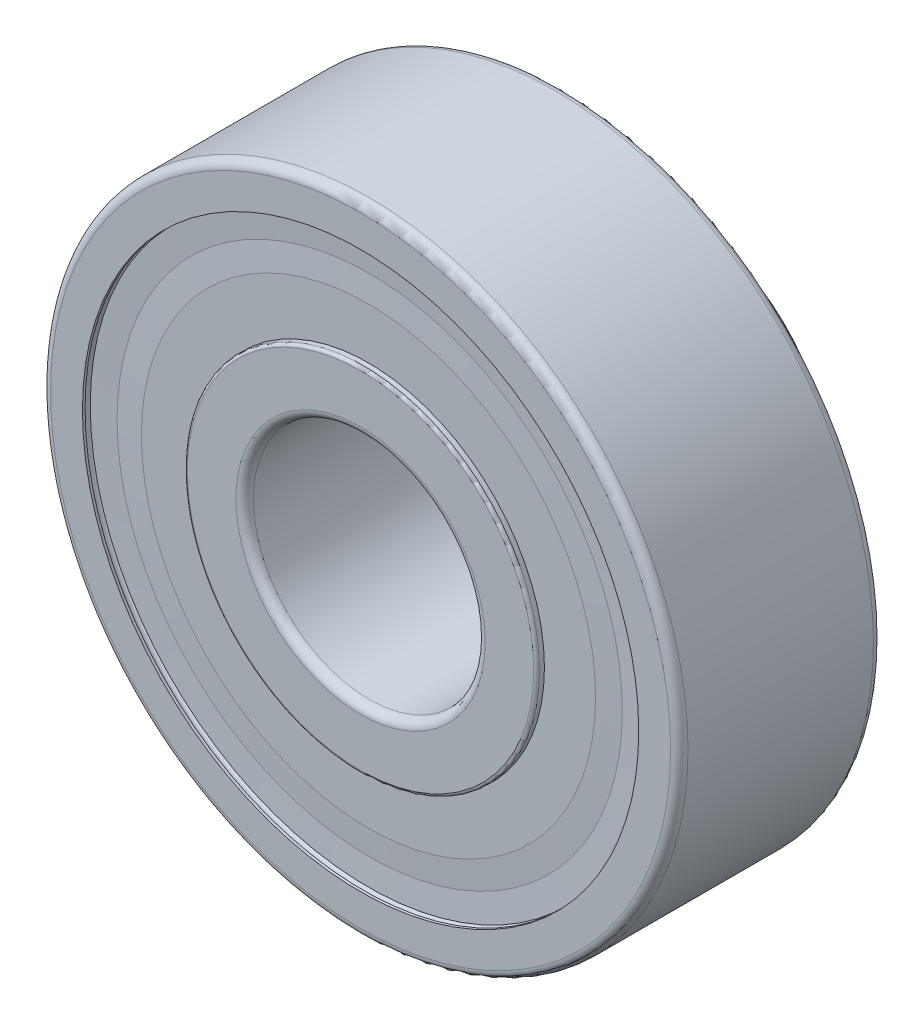
from build123d import *

# Parameters (mm, degrees)
BALL_PATTERN_COUNT              = 7
M3_SET_SCREW_HOLE_PATTERN_COUNT = 2
M3_SET_SCREW_HOLE_PATTERN_ANGLE = 90


with BuildPart() as part:
    # Sketch1 → Bearing Body (revolve)
    with BuildSketch(Plane(origin=(0, 0, 0), x_dir=(0, 0, -1), z_dir=(1, 0, 0))):
        with BuildLine():
            Line((-3.2, 4), (3.2, 4))
            Line((3.2, 4), (7.05, 4))
            ThreePointArc((7.05, 4), (7.262132034, 4.087867966), (7.35, 4.3))
            Line((7.35, 4.3), (7.35, 5.35))
            ThreePointArc((7.35, 5.35), (7.320710678, 5.420710678), (7.25, 5.45))
            Line((7.25, 5.45), (3.6, 5.45))
            Line((3.6, 5.45), (3.5, 5.55))
            Line((3.5, 5.55), (3.5, 5.975))
            ThreePointArc((3.5, 5.975), (3.470710678, 6.045710678), (3.4, 6.075))
            Line((3.4, 6.075), (3.23, 6.075))
            Line((3.23, 6.075), (3.23, 7.8375))
            Line((3.23, 7.8375), (3.185, 8.71875))
            Line((3.185, 8.71875), (3.23, 9.6))
            Line((3.23, 9.6), (3.14, 9.6))
            Line((3.14, 9.6), (3.05, 8.71875))
            Line((3.05, 8.71875), (3.05, 7.8375))
            Line((3.05, 7.8375), (3.14, 6.075))
            Line((3.14, 6.075), (1.520728526, 6.075))
            ThreePointArc((1.520728526, 6.075), (0, 5.3655), (-1.520728526, 6.075))
            Line((-1.520728526, 6.075), (-3.14, 6.075))
            Line((-3.14, 6.075), (-3.05, 7.8375))
            Line((-3.05, 7.8375), (-3.05, 8.71875))
            Line((-3.05, 8.71875), (-3.14, 9.6))
            Line((-3.14, 9.6), (-3.23, 9.6))
            Line((-3.23, 9.6), (-3.185, 8.71875))
            Line((-3.185, 8.71875), (-3.23, 7.8375))
            Line((-3.23, 7.8375), (-3.23, 6.075))
            Line((-3.23, 6.075), (-3.4, 6.075))
            ThreePointArc((-3.4, 6.075), (-3.470710678, 6.045710678), (-3.5, 5.975))
            Line((-3.5, 5.975), (-3.5, 4.3))
            ThreePointArc((-3.5, 4.3), (-3.412132034, 4.087867966), (-3.2, 4))
        make_face()
        with BuildLine():
            Line((-3.5, 9.6), (-3.5, 10.7))
            ThreePointArc((-3.5, 10.7), (-3.412132034, 10.912132034), (-3.2, 11))
            Line((-3.2, 11), (3.2, 11))
            ThreePointArc((3.2, 11), (3.412132034, 10.912132034), (3.5, 10.7))
            Line((3.5, 10.7), (3.5, 9.6))
            Line((3.5, 9.6), (3.41, 9.6))
            ThreePointArc((3.41, 9.6), (3.23, 9.78), (3.05, 9.6))
            Line((3.05, 9.6), (2.908938415, 8.8))
            Line((2.908938415, 8.8), (1.354894922, 8.8))
            ThreePointArc((1.354894922, 8.8), (0, 9.3345), (-1.354894922, 8.8))
            Line((-1.354894922, 8.8), (-2.908938415, 8.8))
            Line((-2.908938415, 8.8), (-3.05, 9.6))
            ThreePointArc((-3.05, 9.6), (-3.23, 9.78), (-3.41, 9.6))
            Line((-3.41, 9.6), (-3.5, 9.6))
        make_face()
    revolve(axis=Axis((0, 0, 3.5), (0, 0, -1)))

    # Sketch6 → M3 Set Screw Hole (revolve, cut)
    with BuildSketch(Plane(origin=(0, 5.45, -5.425), x_dir=(0, 0, 1), z_dir=(1, 0, 0))):
        Polygon((0, 0), (0, 8.251075774), (1.25, 7.5), (1.25, 0), align=None)
    m3_set_screw_hole = revolve(axis=Axis((0, 11.8, -5.425), (0, -1, 0)), mode=Mode.SUBTRACT)

    # M3 Set Screw Hole Pattern: M3 Set Screw Hole ×2 about axis
    m3_set_screw_hole_pattern_axis = Axis((0, 0, -7.05), (0, 0, -1))
    for i in range(1, M3_SET_SCREW_HOLE_PATTERN_COUNT):
        add(m3_set_screw_hole.rotate(m3_set_screw_hole_pattern_axis, i * M3_SET_SCREW_HOLE_PATTERN_ANGLE / (M3_SET_SCREW_HOLE_PATTERN_COUNT - 1)), mode=Mode.SUBTRACT)


with BuildPart() as body_2:
    # Sketch2 → Ball (revolve)
    with BuildSketch(Plane(origin=(0, 0, 0), x_dir=(0, 0, -1), z_dir=(1, 0, 0))):
        with BuildLine():
            Line((1.9845, 7.35), (-1.9845, 7.35))
            ThreePointArc((-1.9845, 7.35), (0, 5.3655), (1.9845, 7.35))
        make_face()
    revolve(axis=Axis((0, 7.35, -1.9845), (0, 0, 1)))


with BuildPart() as ball_pattern_1:
    # Ball Pattern: pattern copy
    add(body_2.part.rotate(Axis((0, 0, -7.05), (0, 0, 1)), 1 * 360 / BALL_PATTERN_COUNT))


with BuildPart() as ball_pattern_2:
    # Ball Pattern: pattern copy
    add(body_2.part.rotate(Axis((0, 0, -7.05), (0, 0, 1)), 2 * 360 / BALL_PATTERN_COUNT))


with BuildPart() as ball_pattern_3:
    # Ball Pattern: pattern copy
    add(body_2.part.rotate(Axis((0, 0, -7.05), (0, 0, 1)), 3 * 360 / BALL_PATTERN_COUNT))


with BuildPart() as ball_pattern_4:
    # Ball Pattern: pattern copy
    add(body_2.part.rotate(Axis((0, 0, -7.05), (0, 0, 1)), 4 * 360 / BALL_PATTERN_COUNT))


with BuildPart() as ball_pattern_5:
    # Ball Pattern: pattern copy
    add(body_2.part.rotate(Axis((0, 0, -7.05), (0, 0, 1)), 5 * 360 / BALL_PATTERN_COUNT))


with BuildPart() as ball_pattern_6:
    # Ball Pattern: pattern copy
    add(body_2.part.rotate(Axis((0, 0, -7.05), (0, 0, 1)), 6 * 360 / BALL_PATTERN_COUNT))


solid = Compound([part.part, body_2.part, ball_pattern_1.part, ball_pattern_2.part, ball_pattern_3.part, ball_pattern_4.part, ball_pattern_5.part, ball_pattern_6.part])
